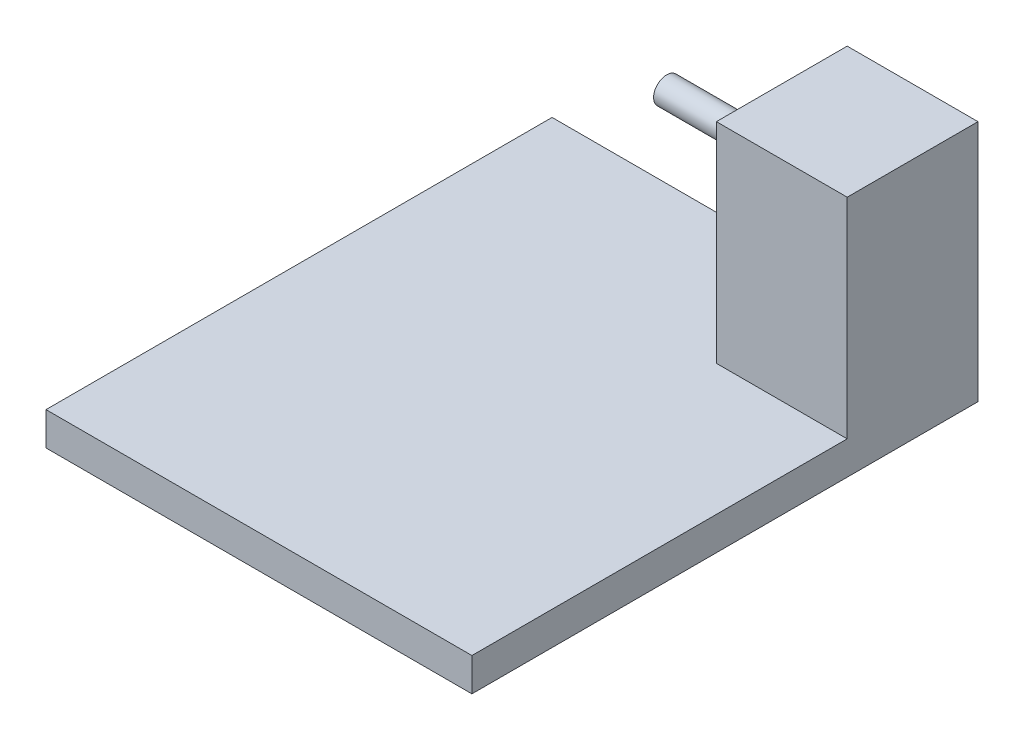
from build123d import *

# Parameters (mm, degrees)
SKETCH1_W           = 81.4
SKETCH1_H           = 96.72
BOSS_EXTRUDE1_DEPTH = 6.35
SKETCH2_W           = 25
SKETCH2_H           = 25
BOSS_EXTRUDE2_DEPTH = 40
SKETCH3_R           = 2.5
BOSS_EXTRUDE3_DEPTH = 22


with BuildPart() as part:
    # Sketch1 → Boss-Extrude1 (new body)
    with BuildSketch(Plane(origin=(0, 0, 0), x_dir=(1, 0, 0), z_dir=(0, 1, 0))):
        Rectangle(SKETCH1_W, SKETCH1_H)
    extrude(amount=BOSS_EXTRUDE1_DEPTH)

    # Sketch2 → Boss-Extrude2 (add)
    with BuildSketch(Plane(origin=(0, 6.35, 0), x_dir=(1, 0, 0), z_dir=(0, 1, 0))):
        with Locations((28.2, 35.86)):
            Rectangle(SKETCH2_W, SKETCH2_H)
    extrude(amount=BOSS_EXTRUDE2_DEPTH)

    # Sketch3 → Boss-Extrude3 (add)
    with BuildSketch(Plane.ZY.offset(-15.7)):
        with Locations(Location((-35.86, 34.35, 0), (0, 0, 180))):
            Circle(SKETCH3_R)
    extrude(amount=BOSS_EXTRUDE3_DEPTH)


solid = part.part
